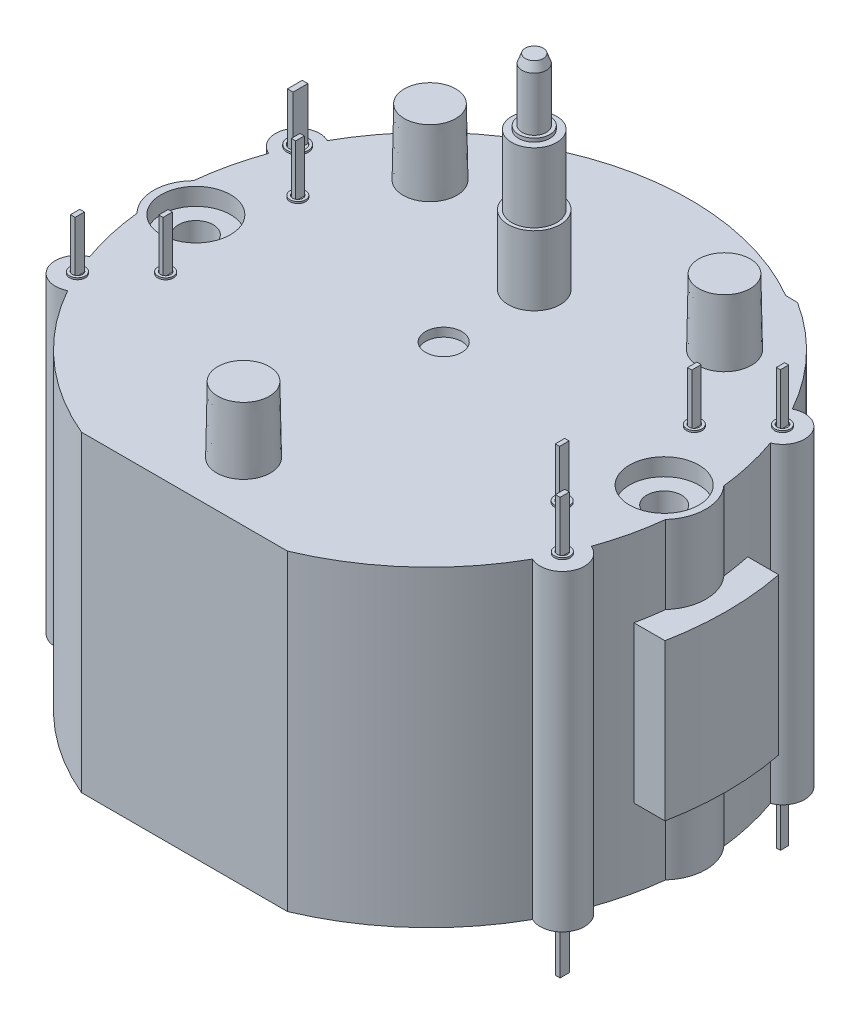
from build123d import *

# Parameters (mm, degrees)
BOSS_EXTRUDE1_DEPTH           = 18
SKETCH3_R                     = 1.5
BOSS_EXTRUDE2_DEPTH           = 4
SKETCH4_R                     = 1.3
BOSS_EXTRUDE3_DEPTH           = 4
SKETCH5_R                     = 0.7
BOSS_EXTRUDE4_DEPTH           = 3.8
CHAMFER1_SIZE                 = 0.5
CHAMFER1_SIZE2                = 0.181985117
SKETCH6_R                     = 1.55
BOSS_EXTRUDE5_DEPTH           = 3.8
BOSS_EXTRUDE5_DRAFT           = 1
BOSS_EXTRUDE5_PROFILE_2_DEPTH = 3.8
BOSS_EXTRUDE5_PROFILE_2_DRAFT = 1
BOSS_EXTRUDE5_PROFILE_3_DEPTH = 3.8
BOSS_EXTRUDE5_PROFILE_3_DRAFT = 1
SKETCH7_R                     = 0.9
SKETCH7_R_2                   = 0.7
EXTRUDE_THIN1_DEPTH           = 0.2
BOSS_EXTRUDE6_START           = 4.5
BOSS_EXTRUDE6_DEPTH           = 9
EXTRUDE_THIN2_DEPTH           = 0.1
EXTRUDE_THIN2_DEPTH_BACK      = 18.1
SKETCH9_R                     = 0.45
SKETCH9_R_2                   = 0.3
SKETCH9_R_3                   = 0.607850945
SKETCH9_R_4                   = 0.457850945
BOSS_EXTRUDE11_DEPTH          = 3
BOSS_EXTRUDE11_DEPTH_BACK     = 21
SKETCH10_W                    = 0.25
SKETCH10_H                    = 0.545435606
BOSS_EXTRUDE11_2_DEPTH        = 3
BOSS_EXTRUDE11_2_DEPTH_BACK   = 21
SKETCH10_H_2                  = 0.5
BOSS_EXTRUDE11_3_DEPTH        = 3
BOSS_EXTRUDE11_3_DEPTH_BACK   = 21
BOSS_EXTRUDE11_4_DEPTH        = 3
BOSS_EXTRUDE11_4_DEPTH_BACK   = 21
BOSS_EXTRUDE11_5_DEPTH        = 3
BOSS_EXTRUDE11_5_DEPTH_BACK   = 21
SKETCH10_W_2                  = 0.270016236
SKETCH10_H_3                  = 0.535808952
BOSS_EXTRUDE11_6_DEPTH        = 3
BOSS_EXTRUDE11_6_DEPTH_BACK   = 21
BOSS_EXTRUDE11_7_DEPTH        = 3
BOSS_EXTRUDE11_7_DEPTH_BACK   = 21
SKETCH10_W_3                  = 0.325209132
SKETCH10_H_4                  = 0.856007577
BOSS_EXTRUDE11_8_DEPTH        = 3
BOSS_EXTRUDE11_8_DEPTH_BACK   = 21
SKETCH10_W_4                  = 0.231071254
SKETCH10_H_5                  = 0.476293902
HOLE1_AT_2_COUNT              = 2
HOLE1_AT_2_PITCH              = 27
SKETCH13_R                    = 1.043626511
CUT_EXTRUDE1_DEPTH            = 0.5


with BuildPart() as part:
    # Sketch2 → Boss-Extrude1 (new body)
    with BuildSketch(Plane(origin=(0, 0, 0), x_dir=(1, 0, 0), z_dir=(0, 1, 0))):
        with BuildLine():
            Line((-7.707373167, 13.276822016), (-7.007172446, 13.262712178))
            ThreePointArc((-7.007172446, 13.262712178), (0.302205651, 14.996955416), (7.535784382, 12.969655113))
            Line((7.535784382, 12.969655113), (8.235985102, 12.955545275))
            ThreePointArc((8.235985102, 12.955545275), (11.158973575, 10.543003022), (13.401838149, 7.487879419))
            ThreePointArc((13.401838149, 7.487879419), (15.143070354, 6.875109695), (14.458305194, 5.160912215))
            ThreePointArc((14.458305194, 5.160912215), (14.96047289, 3.444104368), (15.259534512, 1.680538741))
            ThreePointArc((15.259534512, 1.680538741), (15.906882307, 0), (15.259534512, -1.680538741))
            ThreePointArc((15.259534512, -1.680538741), (14.96047289, -3.444104368), (14.458305194, -5.160912215))
            ThreePointArc((14.458305194, -5.160912215), (15.143070354, -6.875109695), (13.401838149, -7.487879419))
            ThreePointArc((13.401838149, -7.487879419), (10.22863427, -11.447822716), (5.937839448, -14.156965306))
            Line((5.937839448, -14.156965306), (-5.937839448, -14.156965306))
            ThreePointArc((-5.937839448, -14.156965306), (-10.22863427, -11.447822716), (-13.401838149, -7.487879419))
            ThreePointArc((-13.401838149, -7.487879419), (-15.143070354, -6.875109695), (-14.458305194, -5.160912215))
            ThreePointArc((-14.458305194, -5.160912215), (-14.96621686, -3.419057893), (-15.26507495, -1.629444924))
            ThreePointArc((-15.26507495, -1.629444924), (-15.933648133, 0), (-15.26507495, 1.629444924))
            ThreePointArc((-15.26507495, 1.629444924), (-14.96621686, 3.419057893), (-14.458305194, 5.160912215))
            ThreePointArc((-14.458305194, 5.160912215), (-15.143070354, 6.875109695), (-13.401838149, 7.487879419))
            ThreePointArc((-13.401838149, 7.487879419), (-10.944298273, 10.76568341), (-7.707373167, 13.276822016))
        make_face()
    extrude(amount=BOSS_EXTRUDE1_DEPTH)


with BuildPart() as body_2:
    # Sketch3 → Boss-Extrude2 (new body)
    with BuildSketch(Plane(origin=(0, 18, 0), x_dir=(1, 0, 0), z_dir=(0, 1, 0))):
        with Locations(Location((0, 6.009690382, 0), (0, 0, 270))):
            Circle(SKETCH3_R)
    extrude(amount=BOSS_EXTRUDE2_DEPTH)

    # Sketch4 → Boss-Extrude3 (add)
    with BuildSketch(Plane(origin=(0, 22, 0), x_dir=(1, 0, 0), z_dir=(0, 1, 0))):
        with Locations(Location((0, 6.009690382, 0), (0, 0, 270))):
            Circle(SKETCH4_R)
    extrude(amount=BOSS_EXTRUDE3_DEPTH)

    # Sketch5 → Boss-Extrude4 (add)
    with BuildSketch(Plane(origin=(0, 26, 0), x_dir=(1, 0, 0), z_dir=(0, 1, 0))):
        with Locations(Location((0, 6.009690382, 0), (0, 0, 90))):
            Circle(SKETCH5_R)
    extrude(amount=BOSS_EXTRUDE4_DEPTH)

    # Chamfer1
    chamfer1_edges = [body_2.edges().sort_by_distance(p)[0] for p in [
        (0, 29.8, -5.309690382),
    ]]
    chamfer1_side = [body_2.faces().sort_by_distance(p)[0] for p in [
        (0, 27.9, -5.309690382),
    ]]
    chamfer(chamfer1_edges, length=CHAMFER1_SIZE, length2=CHAMFER1_SIZE2, reference=chamfer1_side[0])

    # Sketch7 → Extrude-Thin1 (add)
    with BuildSketch(Plane(origin=(0, 26, 0), x_dir=(1, 0, 0), z_dir=(0, 1, 0))):
        with Locations((0, 6.009690382)):
            Circle(SKETCH7_R)
        with Locations((0, 6.009690382)):
            Circle(SKETCH7_R_2, mode=Mode.SUBTRACT)
    extrude(amount=EXTRUDE_THIN1_DEPTH)


with BuildPart() as boss_extrude5_tool:
    # Sketch6 → Boss-Extrude5 (with draft: the straight prism first)
    with BuildSketch(Plane(origin=(0, 18, 0), x_dir=(1, 0, 0), z_dir=(0, 1, 0))):
        with Locations((0, -10.75)):
            Circle(SKETCH6_R)
    extrude(amount=BOSS_EXTRUDE5_DEPTH)
    # Boss-Extrude5: the draft: its side faces are tilted about the plane it starts from
    boss_extrude5_sides = [boss_extrude5_tool.faces().sort_by_distance(p)[0] for p in [
        (-1.55, 19.9, 10.75),
    ]]
    draft(boss_extrude5_sides, Plane(origin=(0, 18, 0), x_dir=(1, 0, 0), z_dir=(0, 1, 0)), BOSS_EXTRUDE5_DRAFT)


with BuildPart() as part_1:
    add(part.part)

    # Boss-Extrude5: add boss_extrude5_tool
    add(boss_extrude5_tool.part)


with BuildPart() as boss_extrude5_profile_2_tool:
    # Sketch6 → Boss-Extrude5 profile 2 (with draft: the straight prism first)
    with BuildSketch(Plane(origin=(0, 18, 0), x_dir=(1, 0, 0), z_dir=(0, 1, 0))):
        with Locations((8.49, 8.49)):
            Circle(SKETCH6_R)
    extrude(amount=BOSS_EXTRUDE5_PROFILE_2_DEPTH)
    # Boss-Extrude5 profile 2: the draft: its side faces are tilted about the plane it starts from
    boss_extrude5_profile_2_sides = [boss_extrude5_profile_2_tool.faces().sort_by_distance(p)[0] for p in [
        (6.94, 19.9, -8.49),
    ]]
    draft(boss_extrude5_profile_2_sides, Plane(origin=(0, 18, 0), x_dir=(1, 0, 0), z_dir=(0, 1, 0)), BOSS_EXTRUDE5_PROFILE_2_DRAFT)


with BuildPart() as part_2:
    add(part_1.part)

    # Boss-Extrude5 profile 2: add boss_extrude5_profile_2_tool
    add(boss_extrude5_profile_2_tool.part)


with BuildPart() as boss_extrude5_profile_3_tool:
    # Sketch6 → Boss-Extrude5 profile 3 (with draft: the straight prism first)
    with BuildSketch(Plane(origin=(0, 18, 0), x_dir=(1, 0, 0), z_dir=(0, 1, 0))):
        with Locations((-8.49, 8.49)):
            Circle(SKETCH6_R)
    extrude(amount=BOSS_EXTRUDE5_PROFILE_3_DEPTH)
    # Boss-Extrude5 profile 3: the draft: its side faces are tilted about the plane it starts from
    boss_extrude5_profile_3_sides = [boss_extrude5_profile_3_tool.faces().sort_by_distance(p)[0] for p in [
        (-10.04, 19.9, -8.49),
    ]]
    draft(boss_extrude5_profile_3_sides, Plane(origin=(0, 18, 0), x_dir=(1, 0, 0), z_dir=(0, 1, 0)), BOSS_EXTRUDE5_PROFILE_3_DRAFT)


with BuildPart() as part_3:
    add(part_2.part)

    # Boss-Extrude5 profile 3: add boss_extrude5_profile_3_tool
    add(boss_extrude5_profile_3_tool.part)

    # Sketch8 → Boss-Extrude6 (add)
    with BuildSketch(Plane(origin=(0, 0, 0), x_dir=(1, 0, 0), z_dir=(0, 1, 0)).offset(BOSS_EXTRUDE6_START)):
        with BuildLine():
            Line((16.780429705, 3.324572653), (-16.780429705, 3.324572653))
            ThreePointArc((-16.780429705, 3.324572653), (-17.10655136, 0.038793894), (-16.795335829, -3.248430205))
            Line((-16.795335829, -3.248430205), (16.795335829, -3.248430205))
            ThreePointArc((16.795335829, -3.248430205), (17.10655136, 0.038793894), (16.780429705, 3.324572653))
        make_face()
    extrude(amount=BOSS_EXTRUDE6_DEPTH)

    # Sketch9 → Extrude-Thin2 (add, two sides: drawn at the far end of the back side and taken through both)
    # profile 1 of 8: a face of its own
    with BuildSketch(Plane(origin=(0, 18, 0), x_dir=(1, 0, 0), z_dir=(0, 1, 0)).offset(-EXTRUDE_THIN2_DEPTH_BACK)):
        with Locations((-11.43, 3.81)):
            Circle(SKETCH9_R)
        with Locations((-11.43, 3.81)):
            Circle(SKETCH9_R_2, mode=Mode.SUBTRACT)
    # profile 2 of 8: a face of its own
    with BuildSketch(Plane(origin=(0, 18, 0), x_dir=(1, 0, 0), z_dir=(0, 1, 0)).offset(-EXTRUDE_THIN2_DEPTH_BACK)):
        with Locations((-11.43, -3.81)):
            Circle(SKETCH9_R)
        with Locations((-11.43, -3.81)):
            Circle(SKETCH9_R_2, mode=Mode.SUBTRACT)
    # profile 3 of 8: a face of its own
    with BuildSketch(Plane(origin=(0, 18, 0), x_dir=(1, 0, 0), z_dir=(0, 1, 0)).offset(-EXTRUDE_THIN2_DEPTH_BACK)):
        with Locations((11.43, -3.81)):
            Circle(SKETCH9_R)
        with Locations((11.43, -3.81)):
            Circle(SKETCH9_R_2, mode=Mode.SUBTRACT)
    # profile 4 of 8: a face of its own
    with BuildSketch(Plane(origin=(0, 18, 0), x_dir=(1, 0, 0), z_dir=(0, 1, 0)).offset(-EXTRUDE_THIN2_DEPTH_BACK)):
        with Locations((11.43, 3.81)):
            Circle(SKETCH9_R)
        with Locations((11.43, 3.81)):
            Circle(SKETCH9_R_2, mode=Mode.SUBTRACT)
    # profile 5 of 8: a face of its own
    with BuildSketch(Plane(origin=(0, 18, 0), x_dir=(1, 0, 0), z_dir=(0, 1, 0)).offset(-EXTRUDE_THIN2_DEPTH_BACK)):
        with Locations((-13.978576139, 6.346417344)):
            Circle(SKETCH9_R_3)
        with Locations((-13.978576139, 6.346417344)):
            Circle(SKETCH9_R_4, mode=Mode.SUBTRACT)
    # profile 6 of 8: a face of its own
    with BuildSketch(Plane(origin=(0, 18, 0), x_dir=(1, 0, 0), z_dir=(0, 1, 0)).offset(-EXTRUDE_THIN2_DEPTH_BACK)):
        with Locations((-13.978576139, -6.346417344)):
            Circle(SKETCH9_R)
        with Locations((-13.978576139, -6.346417344)):
            Circle(SKETCH9_R_2, mode=Mode.SUBTRACT)
    # profile 7 of 8: a face of its own
    with BuildSketch(Plane(origin=(0, 18, 0), x_dir=(1, 0, 0), z_dir=(0, 1, 0)).offset(-EXTRUDE_THIN2_DEPTH_BACK)):
        with Locations((13.978576139, -6.346417344)):
            Circle(SKETCH9_R)
        with Locations((13.978576139, -6.346417344)):
            Circle(SKETCH9_R_2, mode=Mode.SUBTRACT)
    # profile 8 of 8: a face of its own
    with BuildSketch(Plane(origin=(0, 18, 0), x_dir=(1, 0, 0), z_dir=(0, 1, 0)).offset(-EXTRUDE_THIN2_DEPTH_BACK)):
        with Locations((13.978576139, 6.346417344)):
            Circle(SKETCH9_R)
        with Locations((13.978576139, 6.346417344)):
            Circle(SKETCH9_R_2, mode=Mode.SUBTRACT)
    extrude(amount=EXTRUDE_THIN2_DEPTH + EXTRUDE_THIN2_DEPTH_BACK)

    # Sketch12 → Hole1 (revolve, cut)
    with BuildSketch(Plane(origin=(-13.5, 18, 0), x_dir=(0, 0, 1), z_dir=(1, 0, 0))):
        Polygon((0, 0), (0, 9), (1, 9), (1, 1), (2, 1), (2, 0), align=None)
    hole1 = revolve(axis=Axis((-13.5, -92, 0), (0, 1, 0)), mode=Mode.SUBTRACT)

    # Hole1 at 2: Hole1 ×2
    with Locations(*[(i * HOLE1_AT_2_PITCH, 0, 0) for i in range(1, HOLE1_AT_2_COUNT)]):
        add(hole1, mode=Mode.SUBTRACT)

    # Mirror1: Hole1 across plane
    add(hole1.mirror(Plane.ZX.offset(9)), mode=Mode.SUBTRACT)

    # Mirror1 copy 1 sketch → Mirror1 copy 1 (revolve, cut)
    with BuildSketch(Plane(origin=(13.5, 0, 0), x_dir=(0, 0, 1), z_dir=(1, 0, 0))):
        Polygon((0, 0), (0, -9), (1, -9), (1, -1), (2, -1), (2, 0), align=None)
    revolve(axis=Axis((13.5, 110, 0), (0, 1, 0)), mode=Mode.SUBTRACT)

    # Sketch13 → Cut-Extrude1 (cut)
    with BuildSketch(Plane(origin=(0, 18, 0), x_dir=(1, 0, 0), z_dir=(0, 1, 0))):
        with Locations(Location((0, 0.788989377, 0), (0, 0, 270))):
            Circle(SKETCH13_R)
    extrude(amount=-CUT_EXTRUDE1_DEPTH, mode=Mode.SUBTRACT)


with BuildPart() as body_3:
    # Sketch10 → Boss-Extrude11 (new, two sides: drawn at the far end of the back side and taken through both)
    with BuildSketch(Plane(origin=(0, 18, 0), x_dir=(1, 0, 0), z_dir=(0, 1, 0)).offset(-BOSS_EXTRUDE11_DEPTH_BACK)):
        with Locations((-11.43, -3.81)):
            Rectangle(SKETCH10_W, SKETCH10_H)
    extrude(amount=BOSS_EXTRUDE11_DEPTH + BOSS_EXTRUDE11_DEPTH_BACK)


with BuildPart() as body_4:
    # Sketch10 → Boss-Extrude11 2 (new, two sides: drawn at the far end of the back side and taken through both)
    with BuildSketch(Plane(origin=(0, 18, 0), x_dir=(1, 0, 0), z_dir=(0, 1, 0)).offset(-BOSS_EXTRUDE11_2_DEPTH_BACK)):
        with Locations((-11.43, 3.81)):
            Rectangle(SKETCH10_W, SKETCH10_H_2)
    extrude(amount=BOSS_EXTRUDE11_2_DEPTH + BOSS_EXTRUDE11_2_DEPTH_BACK)


with BuildPart() as body_5:
    # Sketch10 → Boss-Extrude11 3 (new, two sides: drawn at the far end of the back side and taken through both)
    with BuildSketch(Plane(origin=(0, 18, 0), x_dir=(1, 0, 0), z_dir=(0, 1, 0)).offset(-BOSS_EXTRUDE11_3_DEPTH_BACK)):
        with Locations((11.43, 3.81)):
            Rectangle(SKETCH10_W, SKETCH10_H)
    extrude(amount=BOSS_EXTRUDE11_3_DEPTH + BOSS_EXTRUDE11_3_DEPTH_BACK)


with BuildPart() as body_6:
    # Sketch10 → Boss-Extrude11 4 (new, two sides: drawn at the far end of the back side and taken through both)
    with BuildSketch(Plane(origin=(0, 18, 0), x_dir=(1, 0, 0), z_dir=(0, 1, 0)).offset(-BOSS_EXTRUDE11_4_DEPTH_BACK)):
        with Locations((11.43, -3.81)):
            Rectangle(SKETCH10_W, SKETCH10_H)
    extrude(amount=BOSS_EXTRUDE11_4_DEPTH + BOSS_EXTRUDE11_4_DEPTH_BACK)


with BuildPart() as body_7:
    # Sketch10 → Boss-Extrude11 5 (new, two sides: drawn at the far end of the back side and taken through both)
    with BuildSketch(Plane(origin=(0, 18, 0), x_dir=(1, 0, 0), z_dir=(0, 1, 0)).offset(-BOSS_EXTRUDE11_5_DEPTH_BACK)):
        with Locations((13.978576139, -6.346417344)):
            Rectangle(SKETCH10_W_2, SKETCH10_H_3)
    extrude(amount=BOSS_EXTRUDE11_5_DEPTH + BOSS_EXTRUDE11_5_DEPTH_BACK)


with BuildPart() as body_8:
    # Sketch10 → Boss-Extrude11 6 (new, two sides: drawn at the far end of the back side and taken through both)
    with BuildSketch(Plane(origin=(0, 18, 0), x_dir=(1, 0, 0), z_dir=(0, 1, 0)).offset(-BOSS_EXTRUDE11_6_DEPTH_BACK)):
        with Locations((-13.978576139, -6.346417344)):
            Rectangle(SKETCH10_W_2, SKETCH10_H_3)
    extrude(amount=BOSS_EXTRUDE11_6_DEPTH + BOSS_EXTRUDE11_6_DEPTH_BACK)


with BuildPart() as body_9:
    # Sketch10 → Boss-Extrude11 7 (new, two sides: drawn at the far end of the back side and taken through both)
    with BuildSketch(Plane(origin=(0, 18, 0), x_dir=(1, 0, 0), z_dir=(0, 1, 0)).offset(-BOSS_EXTRUDE11_7_DEPTH_BACK)):
        with Locations((-13.978576139, 6.346417344)):
            Rectangle(SKETCH10_W_3, SKETCH10_H_4)
    extrude(amount=BOSS_EXTRUDE11_7_DEPTH + BOSS_EXTRUDE11_7_DEPTH_BACK)


with BuildPart() as body_10:
    # Sketch10 → Boss-Extrude11 8 (new, two sides: drawn at the far end of the back side and taken through both)
    with BuildSketch(Plane(origin=(0, 18, 0), x_dir=(1, 0, 0), z_dir=(0, 1, 0)).offset(-BOSS_EXTRUDE11_8_DEPTH_BACK)):
        with Locations((13.978576139, 6.346417344)):
            Rectangle(SKETCH10_W_4, SKETCH10_H_5)
    extrude(amount=BOSS_EXTRUDE11_8_DEPTH + BOSS_EXTRUDE11_8_DEPTH_BACK)


solid = Compound([body_2.part, part_3.part, body_3.part, body_4.part, body_5.part, body_6.part, body_7.part, body_8.part, body_9.part, body_10.part])
